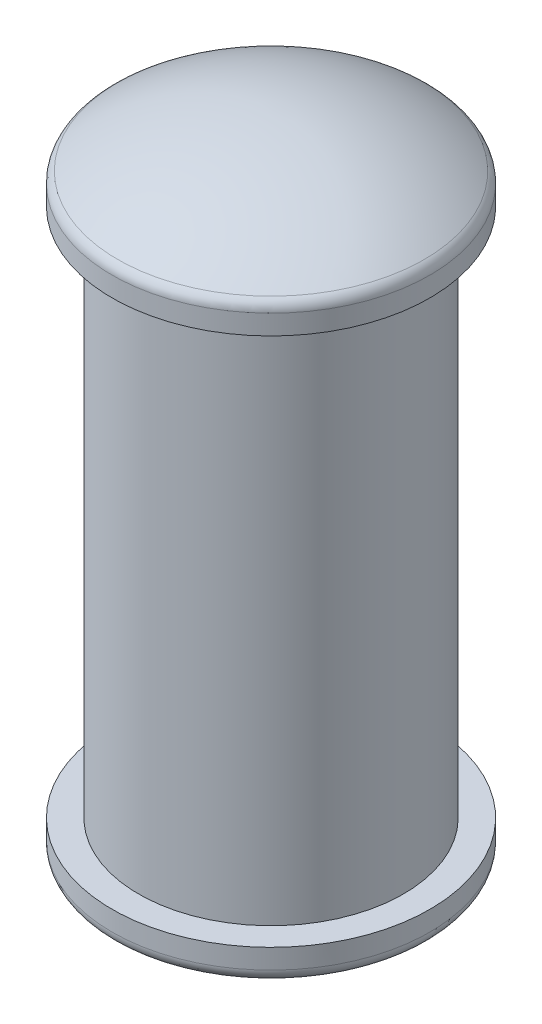
from build123d import *

# Parameters (mm, degrees)
DOME1_FACE_RADIUS          = 3
DOME1_HEIGHT               = 1
MIRROR1_COPY_1_FACE_RADIUS = 3
MIRROR1_COPY_1_HEIGHT      = 1
FILLET1_R                  = 0.25


with BuildPart() as part:
    # Sketch1 → Revolve1 (revolve)
    with BuildSketch(Plane.XY, mode=Mode.PRIVATE) as revolve1_sk:
        Polygon((0, 0), (0, 5.5), (-3, 5.5), (-3, 5), (-2.5, 5), (-2.5, 0), align=None)
    revolve1 = revolve(revolve1_sk.sketch.rotate(Axis((0, 0, 0), (0, 1, 0)), 270), axis=Axis((0, 0, 0), (0, 1, 0)))

    # Dome1: a dome of height H over a round flat face of radius A is a cap of a sphere of radius (A * A + H * H) / (2 * H)
    dome1_r = (DOME1_FACE_RADIUS * DOME1_FACE_RADIUS + DOME1_HEIGHT * DOME1_HEIGHT) / (2 * DOME1_HEIGHT)
    dome1_base = Plane((0, 5.5, 0), z_dir=(0, 1, 0))
    with Locations(dome1_base.offset(DOME1_HEIGHT - dome1_r)):
        dome1_ball = Sphere(dome1_r, mode=Mode.PRIVATE)
    add(split(dome1_ball, bisect_by=dome1_base, keep=Keep.TOP, mode=Mode.PRIVATE))

    # Mirror1: Revolve1 across plane
    add(revolve1.mirror(Plane(origin=(-2.5, 0, 0), x_dir=(0, 0, 1), z_dir=(0, 1, 0))))

    # Mirror1 copy 1: a dome of height H over a round flat face of radius A is a cap of a sphere of radius (A * A + H * H) / (2 * H)
    mirror1_copy_1_r = (MIRROR1_COPY_1_FACE_RADIUS * MIRROR1_COPY_1_FACE_RADIUS + MIRROR1_COPY_1_HEIGHT * MIRROR1_COPY_1_HEIGHT) / (2 * MIRROR1_COPY_1_HEIGHT)
    mirror1_copy_1_base = Plane((0, -5.5, 0), z_dir=(0, -1, 0))
    with Locations(mirror1_copy_1_base.offset(MIRROR1_COPY_1_HEIGHT - mirror1_copy_1_r)):
        mirror1_copy_1_ball = Sphere(mirror1_copy_1_r, mode=Mode.PRIVATE)
    add(split(mirror1_copy_1_ball, bisect_by=mirror1_copy_1_base, keep=Keep.TOP, mode=Mode.PRIVATE))

    # Fillet1
    fillet1_edges = [part.edges().sort_by_distance(p)[0] for p in [
        (0, -5.5, 3),
        (3, 5.5, 0),
    ]]
    fillet(fillet1_edges, radius=FILLET1_R)


solid = part.part
